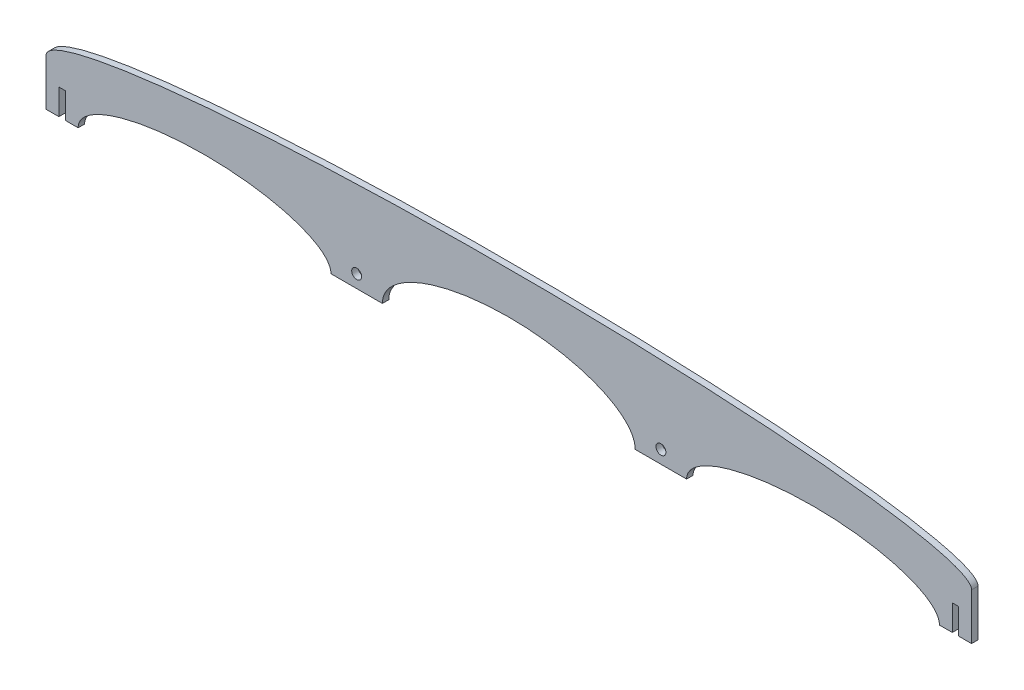
from build123d import *

# Parameters (mm, degrees)
BOSS_EXTRUDE1_DEPTH              = 3.175
F_10_0_1935_DIAMETER_HOLE1_D     = 4.9149
F_10_0_1935_DIAMETER_HOLE1_DEPTH = 19.001994
F_10_0_1935_DIAMETER_HOLE1_TIP   = 1.476584928


with BuildPart() as part:
    # Sketch1 → Boss-Extrude1 (new body)
    with BuildSketch(Plane.XY):
        with BuildLine():
            Line((-228.6, 0), (-228.6, -23.01875))
            Line((-228.6, -23.01875), (-222.25, -23.01875))
            Line((-222.25, -23.01875), (-222.25, -10.31875))
            Line((-222.25, -10.31875), (-219.075, -10.31875))
            Line((-219.075, -10.31875), (-219.075, -23.01875))
            Line((-219.075, -23.01875), (-212.725, -23.01875))
            add(Edge.make_bspline(
                [(-87.841666667, -23.01875), (-87.841666667, -3.292058514), (-150.283333333, -3.292058514), (-212.725, -3.292058514), (-212.725, -23.01875)],
                knots=[0, 0, 0, 1.570796327, 1.570796327, 3.141592654, 3.141592654, 3.141592654], degree=2, weights=[1, 0.707106781, 1, 0.707106781, 1]))
            Line((-87.841666667, -23.01875), (-62.441666667, -23.01875))
            add(Edge.make_bspline(
                [(62.441666667, -23.01875), (62.441666667, 2.38125), (0, 2.38125), (-62.441666667, 2.38125), (-62.441666667, -23.01875)],
                knots=[3.141592654, 3.141592654, 3.141592654, 4.71238898, 4.71238898, 6.283185307, 6.283185307, 6.283185307], degree=2, weights=[1, 0.707106781, 1, 0.707106781, 1]))
            Line((62.441666667, -23.01875), (87.841666667, -23.01875))
            add(Edge.make_bspline(
                [(212.725, -23.01875), (212.725, -3.292058514), (150.283333333, -3.292058514), (87.841666667, -3.292058514), (87.841666667, -23.01875)],
                knots=[0, 0, 0, 1.570796327, 1.570796327, 3.141592654, 3.141592654, 3.141592654], degree=2, weights=[1, 0.707106781, 1, 0.707106781, 1]))
            Line((212.725, -23.01875), (219.075, -23.01875))
            Line((219.075, -23.01875), (219.075, -10.31875))
            Line((219.075, -10.31875), (222.25, -10.31875))
            Line((222.25, -10.31875), (222.25, -23.01875))
            Line((222.25, -23.01875), (228.6, -23.01875))
            Line((228.6, -23.01875), (228.6, 0))
            add(Edge.make_bspline(
                [(228.6, 0), (228.6, 23.01875), (0, 23.01875), (-228.6, 23.01875), (-228.6, 0)],
                knots=[0, 0, 0, 1.570796327, 1.570796327, 3.141592654, 3.141592654, 3.141592654], degree=2, weights=[1, 0.707106781, 1, 0.707106781, 1]))
        make_face()
    extrude(amount=BOSS_EXTRUDE1_DEPTH)

    # #10 (0.1935) Diameter Hole1
    with Locations(Plane.XY.offset(3.175)):
        with Locations((-75.141666667, -16.66875), (75.141666667, -16.66875)):
            Hole(F_10_0_1935_DIAMETER_HOLE1_D / 2, depth=F_10_0_1935_DIAMETER_HOLE1_DEPTH)
            with Locations((0, 0, -(F_10_0_1935_DIAMETER_HOLE1_DEPTH + F_10_0_1935_DIAMETER_HOLE1_TIP / 2))):  # 118° drill point
                Cone(0, F_10_0_1935_DIAMETER_HOLE1_D / 2, F_10_0_1935_DIAMETER_HOLE1_TIP, mode=Mode.SUBTRACT)


solid = part.part
